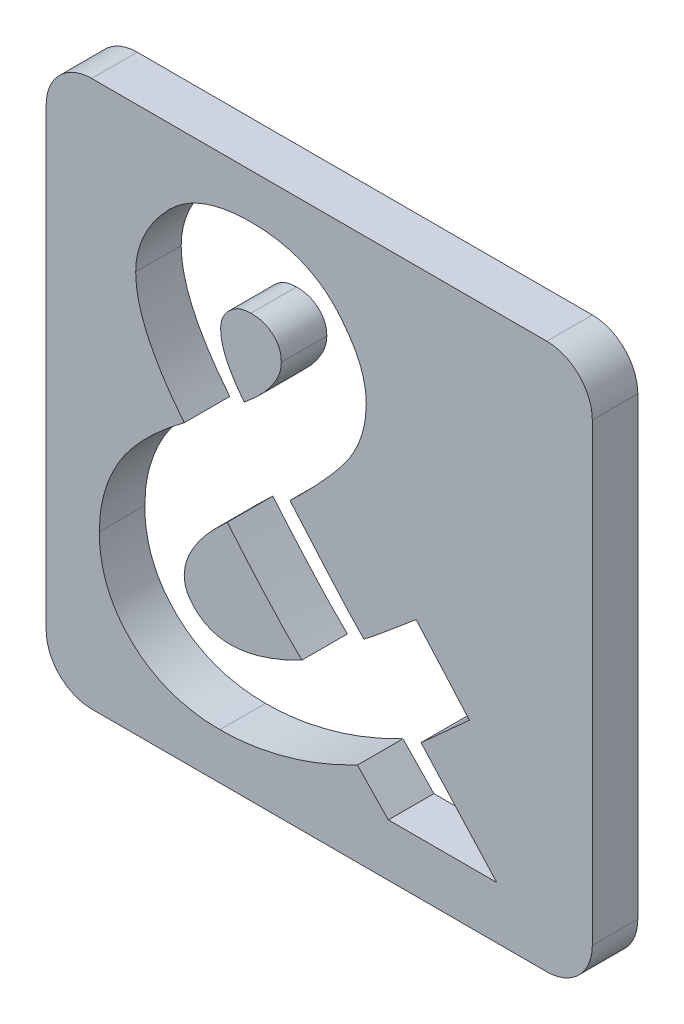
from build123d import *

# Parameters (mm, degrees)
BOSS_EXTRUDE1_DEPTH = 10
CUT_EXTRUDE13_DEPTH = 10


with BuildPart() as part:
    # Sketch1 → Boss-Extrude1 (new body)
    with BuildSketch(Plane.XY):
        with BuildLine():
            Line((-50, 60), (50, 60))
            ThreePointArc((50, 60), (57.071067812, 57.071067812), (60, 50))
            Line((60, 50), (60, -50))
            ThreePointArc((60, -50), (57.071067812, -57.071067812), (50, -60))
            Line((50, -60), (-50, -60))
            ThreePointArc((-50, -60), (-57.071067812, -57.071067812), (-60, -50))
            Line((-60, -50), (-60, 50))
            ThreePointArc((-60, 50), (-57.071067812, 57.071067812), (-50, 60))
        make_face()
    extrude(amount=BOSS_EXTRUDE1_DEPTH)

    # Sketch2 → Cut-Extrude13 (cut)
    with BuildSketch(Plane.XY.offset(10)):
        with BuildLine():
            Line((21.291666667, -7.333333333), (33, -20.625))
            Line((33, -20.625), (27.645833333, -25.458333333))
            Line((27.645833333, -25.458333333), (22.354166667, -30.208333333))
            Line((22.354166667, -30.208333333), (39, -48.5))
            Line((39, -48.5), (15.1875, -48.5))
            Line((15.1875, -48.5), (8.395833333, -41.458333333))
            add(Edge.make_bspline(
                [(8.395833333, -41.458333333), (7.054360025, -42.123304326), (4.425141428, -43.426613224), (0.464045824, -45.135380022), (-3.419738195, -46.585981594), (-7.241299443, -47.753205558), (-10.990315387, -48.673020015), (-14.668391908, -49.34830562), (-18.275135357, -49.762125182), (-20.658690897, -49.809825896), (-21.833333333, -49.833333333)],
                knots=[0, 0, 0, 0, 1.134891057, 2.224328022, 3.268734328, 4.276239557, 5.251753187, 6.19349853, 7.109736169, 8, 8, 8, 8], degree=3))
            add(Edge.make_bspline(
                [(-21.833333333, -49.833333333), (-22.799817125, -49.816904534), (-24.690233141, -49.784770249), (-27.446100863, -49.429235712), (-30.072883625, -48.925209517), (-32.548508844, -48.172354612), (-34.891567932, -47.211706155), (-37.075547019, -46.007759154), (-39.157940368, -44.645998157), (-41.042671122, -43.033604173), (-42.748628894, -41.265605182), (-44.253964676, -39.375463844), (-45.525118776, -37.351122651), (-46.532189727, -35.195480077), (-47.368609584, -32.937059919), (-47.907070207, -30.547112121), (-48.290535138, -28.047102559), (-48.318841597, -26.334906795), (-48.333333333, -25.458333333)],
                knots=[0, 0, 0, 0, 1.146320485, 2.242171696, 3.292771085, 4.317415236, 5.307674559, 6.292327784, 7.272937241, 8.255380553, 9.228759612, 10.185102518, 11.118113404, 12.058159412, 13.004506672, 13.970038596, 14.960743665, 16, 16, 16, 16], degree=3))
            add(Edge.make_bspline(
                [(-48.333333333, -25.458333333), (-48.280560384, -24.127927944), (-48.175455504, -21.478235209), (-47.346882247, -17.568506403), (-46.031120615, -13.771000964), (-44.486898577, -10.723759374), (-42.984501375, -8.323430468), (-41.611982332, -6.521592692), (-40.090802808, -4.679448229), (-38.381369489, -2.828265718), (-36.475040225, -0.965934686), (-34.367632154, 0.892769539), (-32.103380961, 2.80113195), (-30.491863929, 4.021122207), (-29.666666667, 4.645833333)],
                knots=[0, 0, 0, 0, 1.298446345, 2.586041726, 3.88590443, 5.214452458, 5.912551437, 6.649127465, 7.424614693, 8.245404032, 9.108723099, 10.02626188, 10.989322942, 12, 12, 12, 12], degree=3))
            add(Edge.make_bspline(
                [(-29.666666667, 4.645833333), (-30.513003309, 5.719469471), (-32.151318977, 7.797785377), (-34.314456895, 10.968736188), (-36.160730947, 14.031730861), (-37.677970214, 16.999260602), (-38.85432794, 19.877078638), (-39.699127495, 22.664867116), (-40.229531728, 25.361751859), (-40.299366601, 27.136692844), (-40.333333333, 28)],
                knots=[0, 0, 0, 0, 1.254783331, 2.428975762, 3.521264868, 4.536304978, 5.485798762, 6.371253184, 7.2077997, 8, 8, 8, 8], degree=3))
            add(Edge.make_bspline(
                [(-40.333333333, 28), (-40.312889987, 28.626211627), (-40.271753214, 29.886295247), (-39.947798921, 31.766390051), (-39.414929914, 33.640346899), (-38.696151933, 35.51021522), (-37.72760518, 37.353576561), (-36.617252846, 39.219582194), (-35.240155284, 41.048145786), (-33.700114414, 42.866816453), (-31.984681353, 44.596658981), (-30.037601219, 46.077460761), (-27.954558275, 47.366449647), (-25.67087738, 48.381671188), (-23.239553133, 49.202750617), (-20.623124628, 49.748773873), (-17.851147909, 50.122964019), (-15.93883567, 50.151853914), (-14.958333333, 50.166666667)],
                knots=[0, 0, 0, 0, 0.804005245, 1.617845782, 2.442417892, 3.303751945, 4.185353306, 5.113895693, 6.089730109, 7.121057753, 8.174368357, 9.210928466, 10.255745102, 11.313577991, 12.413626417, 13.545577246, 14.741540635, 16, 16, 16, 16], degree=3))
            add(Edge.make_bspline(
                [(-14.958333333, 50.166666667), (-13.970949434, 50.151698804), (-12.044922264, 50.122501943), (-9.251457276, 49.750295065), (-6.625527502, 49.198947689), (-4.178300282, 48.409455826), (-1.906582487, 47.381824391), (0.180673487, 46.127086836), (2.10954979, 44.658504326), (3.80224014, 42.94885723), (5.328941921, 41.160875063), (6.646457253, 39.334007497), (7.783413608, 37.515005279), (8.723513888, 35.694467507), (9.446600069, 33.858903155), (9.941138122, 32.012818078), (10.27215253, 30.164589329), (10.313101423, 28.924968328), (10.333333333, 28.3125)],
                knots=[0, 0, 0, 0, 1.276734626, 2.490445286, 3.63953842, 4.744903521, 5.810549869, 6.858432609, 7.890047049, 8.938430496, 9.964709099, 10.929889513, 11.849973453, 12.738086576, 13.577403443, 14.397009003, 15.207998884, 16, 16, 16, 16], degree=3))
            add(Edge.make_bspline(
                [(10.333333333, 28.3125), (10.298161399, 27.351307172), (10.228224476, 25.440042712), (9.634270585, 22.610597411), (8.692201446, 19.846593109), (7.584023416, 17.573818753), (6.428444373, 15.712126054), (5.310044928, 14.144266694), (3.957245933, 12.417981844), (2.340171818, 10.551140751), (0.506800264, 8.502364458), (-1.582488738, 6.298540674), (-3.909226095, 3.922948422), (-5.572368565, 2.315386355), (-6.4375, 1.479166667)],
                knots=[0, 0, 0, 0, 1.060977453, 2.109679181, 3.179605993, 4.281004361, 4.894184227, 5.598751118, 6.407550161, 7.316246525, 8.32673215, 9.444732117, 10.670803848, 12, 12, 12, 12], degree=3))
            add(Edge.make_bspline(
                [(-6.4375, 1.479166667), (-5.43142849, 0.31173941), (-3.519095021, -1.907297899), (-0.786849872, -5.050415847), (1.649168852, -7.862692288), (3.84570179, -10.294508492), (5.698398029, -12.444490766), (7.337889659, -14.182846507), (8.665601804, -15.604827459), (9.46437096, -16.431413947), (9.8125, -16.791666667)],
                knots=[0, 0, 0, 0, 1.512435367, 2.874826234, 4.08718363, 5.163660462, 6.090727043, 6.871951442, 7.508360509, 8, 8, 8, 8], degree=3))
            add(Edge.make_bspline(
                [(9.8125, -16.791666667), (10.03414796, -16.617318322), (10.551651189, -16.210250144), (11.457829222, -15.530890747), (12.559262542, -14.622439995), (13.879798281, -13.525224403), (15.427969327, -12.255251658), (17.184863101, -10.789857196), (19.157685998, -9.122578126), (20.555131385, -7.950884344), (21.291666667, -7.333333333)],
                knots=[0, 0, 0, 0, 0.454985294, 1.062298784, 1.826991184, 2.758032328, 3.832541496, 5.05766532, 6.449217892, 8, 8, 8, 8], degree=3))
        make_face()
        with BuildLine():
            add(Edge.make_bspline(
                [(-16.458333333, 15.1875), (-15.820673107, 15.722656961), (-14.595944306, 16.75051179), (-12.934531607, 18.323842818), (-11.514161327, 19.851308864), (-10.373205614, 21.339418105), (-9.471894079, 22.781036235), (-8.81738434, 24.166769592), (-8.412262209, 25.526066258), (-8.359065515, 26.421182908), (-8.333333333, 26.854166667)],
                knots=[0, 0, 0, 0, 1.365060885, 2.621818505, 3.750342301, 4.782258275, 5.692552235, 6.533361441, 7.290560982, 8, 8, 8, 8], degree=3))
            add(Edge.make_bspline(
                [(-8.333333333, 26.854166667), (-8.346698479, 27.281249901), (-8.372426054, 28.103374574), (-8.760528014, 29.258964356), (-9.319248267, 30.313322328), (-10.147322945, 31.194655262), (-11.131531616, 31.944431543), (-12.295930867, 32.456553436), (-13.600305813, 32.783305388), (-14.518676822, 32.816129854), (-15, 32.833333333)],
                knots=[0, 0, 0, 0, 1.014099219, 1.952115937, 2.87909245, 3.840951669, 4.811901314, 5.812921866, 6.853740603, 8, 8, 8, 8], degree=3))
            add(Edge.make_bspline(
                [(-15, 32.833333333), (-15.445864634, 32.805640038), (-16.322445641, 32.751194328), (-17.599722481, 32.42972274), (-18.735676798, 31.793529479), (-19.755247802, 30.988962738), (-20.595594816, 30.027481927), (-21.230044989, 28.959260175), (-21.589835511, 27.793374227), (-21.640947162, 26.988398864), (-21.666666667, 26.583333333)],
                knots=[0, 0, 0, 0, 1.057365327, 2.078806644, 3.087050319, 4.117196135, 5.143130812, 6.093917617, 7.040854779, 8, 8, 8, 8], degree=3))
            add(Edge.make_bspline(
                [(-21.666666667, 26.583333333), (-21.650323124, 26.15843933), (-21.616833534, 25.287788085), (-21.343342006, 23.971341898), (-20.952891278, 22.597821644), (-20.359134077, 21.197049443), (-19.620847046, 19.742487343), (-18.726151657, 18.255519823), (-17.674878362, 16.713229864), (-16.875009665, 15.710074593), (-16.458333333, 15.1875)],
                knots=[0, 0, 0, 0, 0.79851103, 1.636230724, 2.520809257, 3.481398485, 4.492018109, 5.587460843, 6.74323377, 8, 8, 8, 8], degree=3))
        make_face(mode=Mode.SUBTRACT)
        with BuildLine():
            add(Edge.make_bspline(
                [(-3.8125, -27.604166667), (-4.320351903, -27.112063513), (-5.399482098, -26.066397701), (-7.09060091, -24.388390872), (-8.898603912, -22.453424442), (-10.880001433, -20.315812925), (-12.996234636, -17.939467214), (-15.271986181, -15.347395046), (-17.71088158, -12.547732928), (-19.357637562, -10.579346482), (-20.208333333, -9.5625)],
                knots=[0, 0, 0, 0, 0.695851971, 1.478609945, 2.343846541, 3.301331317, 4.346617988, 5.474767113, 6.695492858, 8, 8, 8, 8], degree=3))
            add(Edge.make_bspline(
                [(-20.208333333, -9.5625), (-20.951787702, -10.256382763), (-22.381266279, -11.590547423), (-24.314199458, -13.622963189), (-25.961561806, -15.579880214), (-27.281302707, -17.490991616), (-28.340881475, -19.322661369), (-29.107151829, -21.100378204), (-29.572172843, -22.823547026), (-29.635995471, -23.955849979), (-29.666666667, -24.5)],
                knots=[0, 0, 0, 0, 1.345056216, 2.586209894, 3.708339041, 4.725117826, 5.654925694, 6.502941046, 7.280559447, 8, 8, 8, 8], degree=3))
            add(Edge.make_bspline(
                [(-29.666666667, -24.5), (-29.626130808, -24.990059699), (-29.543982873, -25.983190075), (-29.001051108, -27.436830234), (-28.055230627, -28.785202922), (-26.831276539, -30.066156622), (-25.296914894, -31.127869402), (-23.558320286, -31.949889983), (-21.612404616, -32.398864778), (-20.2590532, -32.465634468), (-19.5625, -32.5)],
                knots=[0, 0, 0, 0, 0.827700581, 1.677376432, 2.581631432, 3.593486174, 4.654183907, 5.714103338, 6.823477321, 8, 8, 8, 8], degree=3))
            add(Edge.make_bspline(
                [(-19.5625, -32.5), (-19.02011253, -32.481425208), (-17.896286622, -32.442938272), (-16.169868486, -32.199719927), (-14.344204862, -31.826073314), (-12.428563787, -31.272166625), (-10.406729501, -30.581127282), (-8.281095675, -29.752265482), (-6.070993297, -28.74144851), (-4.580873755, -27.99108724), (-3.8125, -27.604166667)],
                knots=[0, 0, 0, 0, 0.782455748, 1.62124697, 2.511300074, 3.469084929, 4.495559399, 5.593194182, 6.758940896, 8, 8, 8, 8], degree=3))
        make_face(mode=Mode.SUBTRACT)
    extrude(amount=-CUT_EXTRUDE13_DEPTH, mode=Mode.SUBTRACT)


with BuildPart() as cut_extrude13_piece_1:
    # of the separate pieces the step leaves, piece 1, a body of its own (cut_extrude13_pieces)
    add(part.part.solids().sort_by_distance((-50, 60, 0))[0])


with BuildPart() as cut_extrude13_piece_2:
    # of the separate pieces the step leaves, piece 2, a body of its own (cut_extrude13_pieces)
    add(part.part.solids().sort_by_distance((-3.8125, -27.604166667, 0))[0])


with BuildPart() as cut_extrude13_piece_3:
    # of the separate pieces the step leaves, piece 3, a body of its own (cut_extrude13_pieces)
    add(part.part.solids().sort_by_distance((-16.458333333, 15.1875, 0))[0])


solid = Compound([cut_extrude13_piece_1.part, cut_extrude13_piece_2.part, cut_extrude13_piece_3.part])
